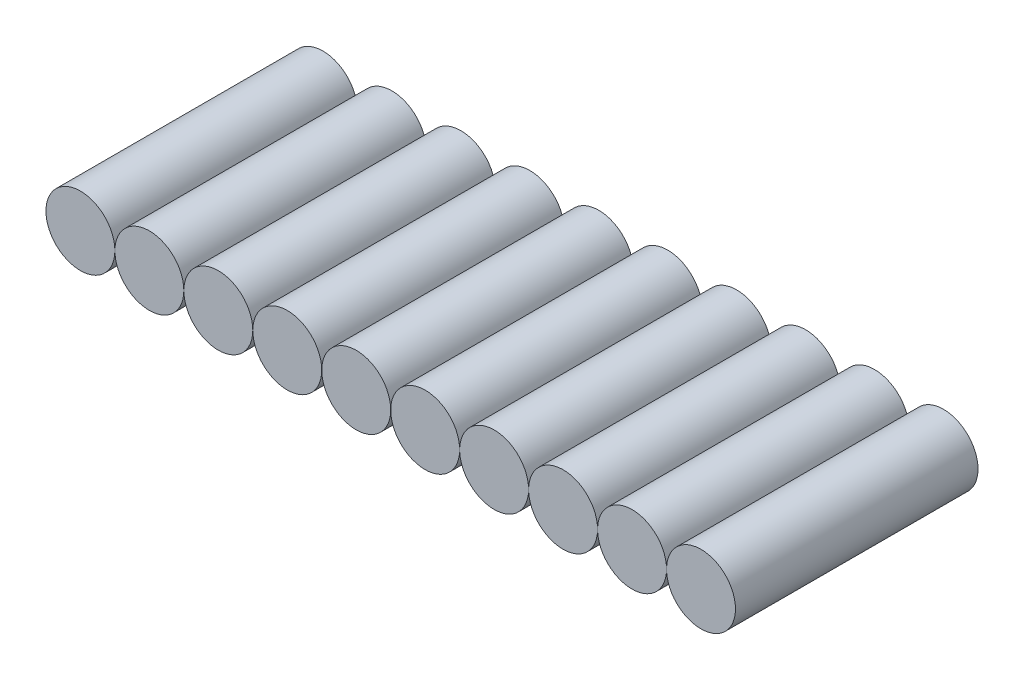
from build123d import *

# Parameters (mm, degrees)
ESQUISSE1_R           = 7.25
BOSS_EXTRU_1_DEPTH    = 51
BOSS_EXTRU_1_2_DEPTH  = 51
BOSS_EXTRU_1_3_DEPTH  = 51
BOSS_EXTRU_1_4_DEPTH  = 51
BOSS_EXTRU_1_5_DEPTH  = 51
BOSS_EXTRU_1_6_DEPTH  = 51
BOSS_EXTRU_1_7_DEPTH  = 51
BOSS_EXTRU_1_8_DEPTH  = 51
BOSS_EXTRU_1_9_DEPTH  = 51
BOSS_EXTRU_1_10_DEPTH = 51


with BuildPart() as part:
    # Esquisse1 → Boss.-Extru.1 (new body)
    with BuildSketch(Plane.XY):
        with Locations((14.5, 0)):
            Circle(ESQUISSE1_R)
    extrude(amount=BOSS_EXTRU_1_DEPTH)


with BuildPart() as body_2:
    # Esquisse1 → Boss.-Extru.1 2 (new body)
    with BuildSketch(Plane.XY):
        with Locations((29, 0)):
            Circle(ESQUISSE1_R)
    extrude(amount=BOSS_EXTRU_1_2_DEPTH)


with BuildPart() as body_3:
    # Esquisse1 → Boss.-Extru.1 3 (new body)
    with BuildSketch(Plane.XY):
        with Locations((43.5, 0)):
            Circle(ESQUISSE1_R)
    extrude(amount=BOSS_EXTRU_1_3_DEPTH)


with BuildPart() as body_4:
    # Esquisse1 → Boss.-Extru.1 4 (new body)
    with BuildSketch(Plane.XY):
        Circle(ESQUISSE1_R)
    extrude(amount=BOSS_EXTRU_1_4_DEPTH)


with BuildPart() as body_5:
    # Esquisse1 → Boss.-Extru.1 5 (new body)
    with BuildSketch(Plane.XY):
        with Locations((58, 0)):
            Circle(ESQUISSE1_R)
    extrude(amount=BOSS_EXTRU_1_5_DEPTH)


with BuildPart() as body_6:
    # Esquisse1 → Boss.-Extru.1 6 (new body)
    with BuildSketch(Plane.XY):
        with Locations((72.5, 0)):
            Circle(ESQUISSE1_R)
    extrude(amount=BOSS_EXTRU_1_6_DEPTH)


with BuildPart() as body_7:
    # Esquisse1 → Boss.-Extru.1 7 (new body)
    with BuildSketch(Plane.XY):
        with Locations((87, 0)):
            Circle(ESQUISSE1_R)
    extrude(amount=BOSS_EXTRU_1_7_DEPTH)


with BuildPart() as body_8:
    # Esquisse1 → Boss.-Extru.1 8 (new body)
    with BuildSketch(Plane.XY):
        with Locations((101.5, 0)):
            Circle(ESQUISSE1_R)
    extrude(amount=BOSS_EXTRU_1_8_DEPTH)


with BuildPart() as body_9:
    # Esquisse1 → Boss.-Extru.1 9 (new body)
    with BuildSketch(Plane.XY):
        with Locations((116, 0)):
            Circle(ESQUISSE1_R)
    extrude(amount=BOSS_EXTRU_1_9_DEPTH)


with BuildPart() as body_10:
    # Esquisse1 → Boss.-Extru.1 10 (new body)
    with BuildSketch(Plane.XY):
        with Locations((130.5, 0)):
            Circle(ESQUISSE1_R)
    extrude(amount=BOSS_EXTRU_1_10_DEPTH)


solid = Compound([part.part, body_2.part, body_3.part, body_4.part, body_5.part, body_6.part, body_7.part, body_8.part, body_9.part, body_10.part])
